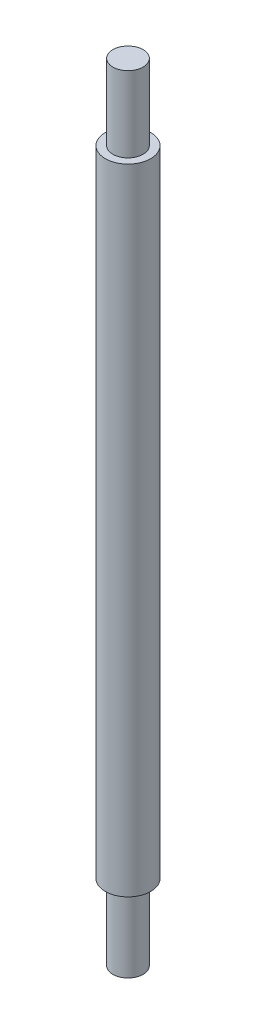
from build123d import *

# Parameters (mm, degrees)
SKETCH1_R           = 2
BOSS_EXTRUDE1_DEPTH = 10
SKETCH2_R           = 3
BOSS_EXTRUDE2_DEPTH = 84
SKETCH3_R           = 2
BOSS_EXTRUDE3_DEPTH = 10


with BuildPart() as part:
    # Sketch1 → Boss-Extrude1 (new body)
    with BuildSketch(Plane(origin=(0, 0, 0), x_dir=(1, 0, 0), z_dir=(0, 1, 0))):
        with Locations(Location((0, 0, 0), (0, 0, 270))):
            Circle(SKETCH1_R)
    extrude(amount=BOSS_EXTRUDE1_DEPTH)


with BuildPart() as body_2:
    # Sketch2 → Boss-Extrude2 (new body)
    with BuildSketch(Plane(origin=(0, 10, 0), x_dir=(1, 0, 0), z_dir=(0, 1, 0))):
        with Locations(Location((0, 0, 0), (0, 0, 90))):
            Circle(SKETCH2_R)
    extrude(amount=BOSS_EXTRUDE2_DEPTH)

    # Sketch3 → Boss-Extrude3 (add)
    with BuildSketch(Plane(origin=(0, 94, 0), x_dir=(1, 0, 0), z_dir=(0, 1, 0))):
        with Locations(Location((0, 0, 0), (0, 0, 270))):
            Circle(SKETCH3_R)
    extrude(amount=BOSS_EXTRUDE3_DEPTH)


solid = Compound([part.part, body_2.part])
